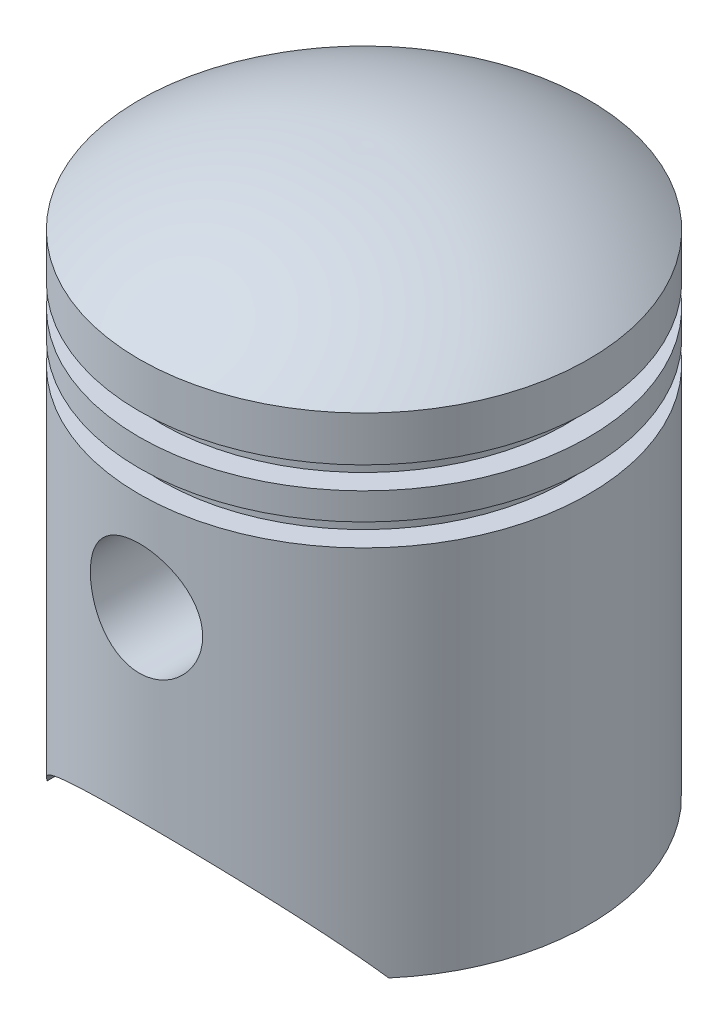
from build123d import *

# Parameters (mm, degrees)
CUT_EXTRUDE1_DEPTH       = 72.817566835
CUT_EXTRUDE1_DEPTH_BACK  = 72.817566835
SKETCH5_R                = 6.25
BOSS_EXTRUDE1_REACH      = 85.818
BOSS_EXTRUDE1_END_RADIUS = 23
BOSS_EXTRUDE1_START      = 12
SKETCH6_R                = 7.25
SKETCH6_R_2              = 6.25


with BuildPart() as part:
    # Sketch1 → Revolve1 (revolve)
    with BuildSketch(Plane.XY, mode=Mode.PRIVATE) as revolve1_sk:
        with BuildLine():
            Line((25, 0), (25, 41.5))
            Line((25, 41.5), (22.5, 41.5))
            Line((22.5, 41.5), (22.5, 44))
            Line((22.5, 44), (25, 44))
            Line((25, 44), (25, 47))
            Line((25, 47), (22.5, 47))
            Line((22.5, 47), (22.5, 49.5))
            Line((22.5, 49.5), (25, 49.5))
            Line((25, 49.5), (25, 54.5))
            ThreePointArc((25, 54.5), (13.174901691, 60.609067785), (0, 62.5))
            Line((0, 62.5), (0, 60.49936285))
            ThreePointArc((0, 60.49936285), (12.069492637, 58.859165445), (23, 53.484511145))
            Line((23, 53.484511145), (23, 51.5))
            Line((23, 51.5), (20.5, 51.5))
            Line((20.5, 51.5), (20.5, 45.5))
            Line((20.5, 45.5), (20.5, 39.5))
            Line((20.5, 39.5), (23, 39.5))
            Line((23, 39.5), (23, 0))
            Line((23, 0), (25, 0))
        make_face()
    revolve(revolve1_sk.sketch.rotate(Axis((0, 62.5, 0), (0, -1, 0)), 90), axis=Axis((0, 62.5, 0), (0, -1, 0)))

    # Sketch5 → Cut-Extrude1 (cut, two sides: drawn at the far end of the back side and taken through both)
    with BuildSketch(Plane.XY.offset(-CUT_EXTRUDE1_DEPTH_BACK)):
        with Locations((0, 30.5)):
            Circle(SKETCH5_R)
        with BuildLine():
            Line((-19, 0), (19, 0))
            ThreePointArc((19, 0), (0, 10), (-19, 0))
        make_face()
    extrude(amount=CUT_EXTRUDE1_DEPTH + CUT_EXTRUDE1_DEPTH_BACK, mode=Mode.SUBTRACT)

    # Boss-Extrude1: up to this cylinder (the profile starts inside it)
    boss_extrude1_end = Plane(origin=(0, 23.455061, 0), z_dir=(0, 1, 0)) * Cylinder(BOSS_EXTRUDE1_END_RADIUS, 218.636, mode=Mode.PRIVATE)
    # Sketch6 → Boss-Extrude1 (add, up to the surface)
    with BuildSketch(Plane.XY.offset(BOSS_EXTRUDE1_START), mode=Mode.PRIVATE) as boss_extrude1_sk1:
        with Locations(Location((0, 30.5, 0), (0, 0, 90))):
            Circle(SKETCH6_R)
        with Locations((0, 30.5)):
            Circle(SKETCH6_R_2, mode=Mode.SUBTRACT)
    boss_extrude1_tool1 = extrude(boss_extrude1_sk1.sketch, amount=BOSS_EXTRUDE1_REACH, mode=Mode.PRIVATE) & boss_extrude1_end
    boss_extrude1 = boss_extrude1_tool1.solids().sort_by_distance((0, 23.455061, 12))[0]
    add(boss_extrude1)

    # Mirror1: Boss-Extrude1 across plane
    add(boss_extrude1.mirror(Plane.XY))


solid = part.part
